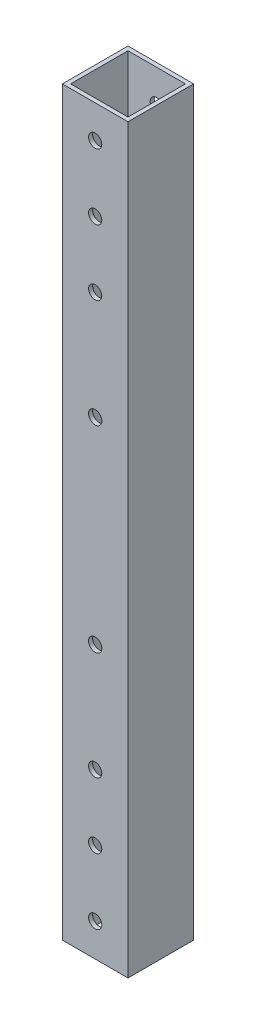
from build123d import *

# Parameters (mm, degrees)
SKETCH1_W                        = 25.4
SKETCH1_H                        = 25.4
SKETCH1_W_2                      = 22.225
SKETCH1_H_2                      = 22.225
BOSS_EXTRUDE1_DEPTH              = 287.02
F_10_CLEARANCE_HOLE1_D           = 5.1054
F_13_64_0_20313_DIAMETER_HOLE1_D = 5.159502


with BuildPart() as part:
    # Sketch1 → Boss-Extrude1 (new body)
    with BuildSketch(Plane(origin=(0, 0, 0), x_dir=(1, 0, 0), z_dir=(0, 1, 0))):
        Rectangle(SKETCH1_W, SKETCH1_H)
        Rectangle(SKETCH1_W_2, SKETCH1_H_2, mode=Mode.SUBTRACT)
    extrude(amount=BOSS_EXTRUDE1_DEPTH)

    # #10 Clearance Hole1 (through all)
    with Locations(Plane.XY.offset(12.7)):
        with Locations((0, 274.32), (0, 248.92), (0, 223.52), (0, 63.5), (0, 38.1), (0, 12.7)):
            Hole(F_10_CLEARANCE_HOLE1_D / 2)

    # 13/64 (0.20313) Diameter Hole1 (through all)
    with Locations(Plane(origin=(-522.170199168, -199.39, -12.7), x_dir=(0, 1, 0), z_dir=(0, 0, -1))):
        with Locations((304.8, 522.170199168), (381, 522.170199168)):
            Hole(F_13_64_0_20313_DIAMETER_HOLE1_D / 2)


solid = part.part
